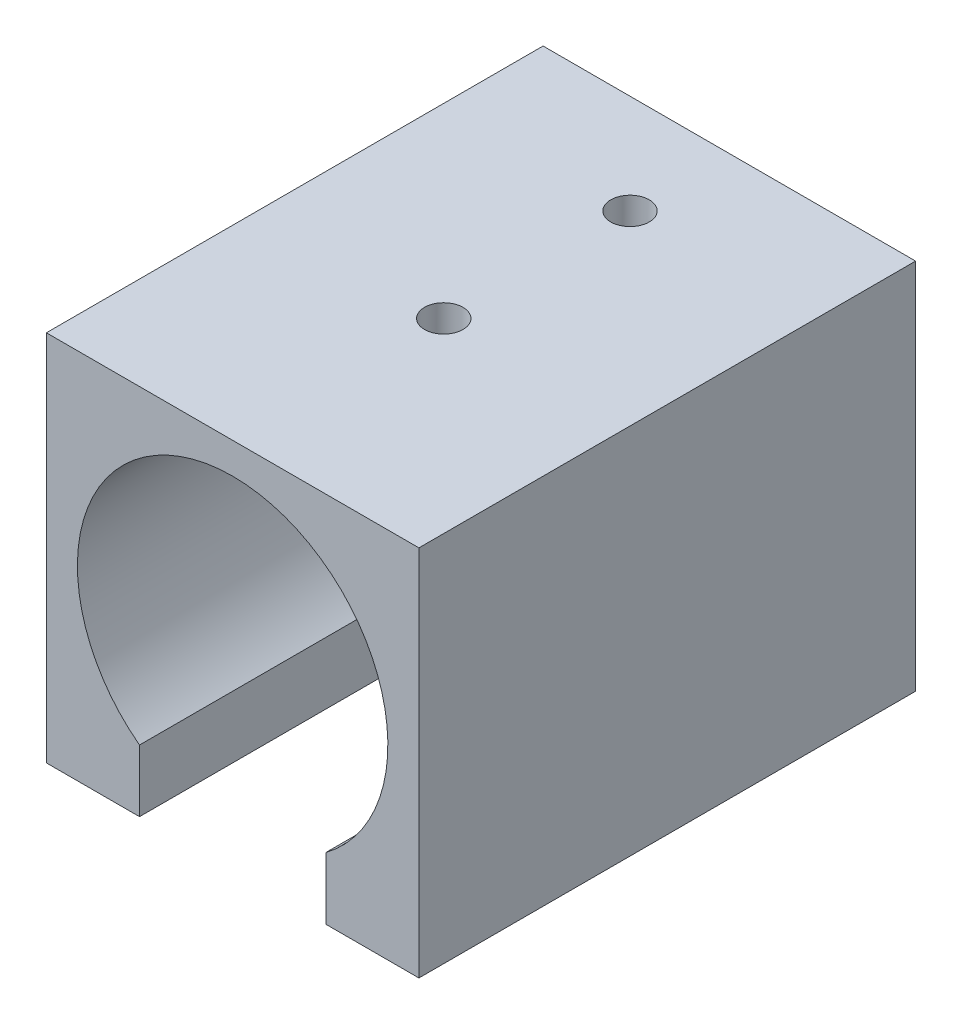
from build123d import *

# Parameters (mm, degrees)
BOSS_EXTRUDE1_DEPTH     = 20
CUT_EXTRUDE1_REACH      = 41.051
CUT_EXTRUDE1_END_RADIUS = 12.5
SKETCH2_R               = 1.55


with BuildPart() as part:
    # Sketch1 → Boss-Extrude1 (new, symmetric)
    with BuildSketch(Plane.XY):
        with BuildLine():
            Line((-15, 15), (15, 15))
            Line((15, 15), (15, -15))
            Line((15, -15), (7.5, -15))
            Line((7.5, -15), (7.5, -10))
            ThreePointArc((7.5, -10), (0, 12.5), (-7.5, -10))
            Line((-7.5, -10), (-7.5, -15))
            Line((-7.5, -15), (-15, -15))
            Line((-15, -15), (-15, 15))
        make_face()
    extrude(amount=BOSS_EXTRUDE1_DEPTH, both=True)

    # Cut-Extrude1: up to this cylinder (the profile starts outside it)
    cut_extrude1_end = Plane(origin=(0, 0, -4.5), z_dir=(0, 0, -1)) * Cylinder(CUT_EXTRUDE1_END_RADIUS, 123.102, mode=Mode.PRIVATE)
    # Sketch2 → Cut-Extrude1 (cut, up to the surface)
    with BuildSketch(Plane(origin=(0, 15, 0), x_dir=(1, 0, 0), z_dir=(0, 1, 0)), mode=Mode.PRIVATE) as cut_extrude1_sk1:
        with Locations(Location((0, 12, 0), (0, 0, 270))):
            Circle(SKETCH2_R)
    cut_extrude1_tool1 = extrude(cut_extrude1_sk1.sketch, amount=-CUT_EXTRUDE1_REACH, mode=Mode.PRIVATE) - cut_extrude1_end
    add(cut_extrude1_tool1.solids().sort_by_distance((0, 15, -12))[0], mode=Mode.SUBTRACT)
    # Sketch2 → Cut-Extrude1 (cut, up to the surface)
    with BuildSketch(Plane(origin=(0, 15, 0), x_dir=(1, 0, 0), z_dir=(0, 1, 0)), mode=Mode.PRIVATE) as cut_extrude1_sk2:
        with Locations(Location((0, -3, 0), (0, 0, 270))):
            Circle(SKETCH2_R)
    cut_extrude1_tool2 = extrude(cut_extrude1_sk2.sketch, amount=-CUT_EXTRUDE1_REACH, mode=Mode.PRIVATE) - cut_extrude1_end
    add(cut_extrude1_tool2.solids().sort_by_distance((0, 15, 3))[0], mode=Mode.SUBTRACT)


solid = part.part
